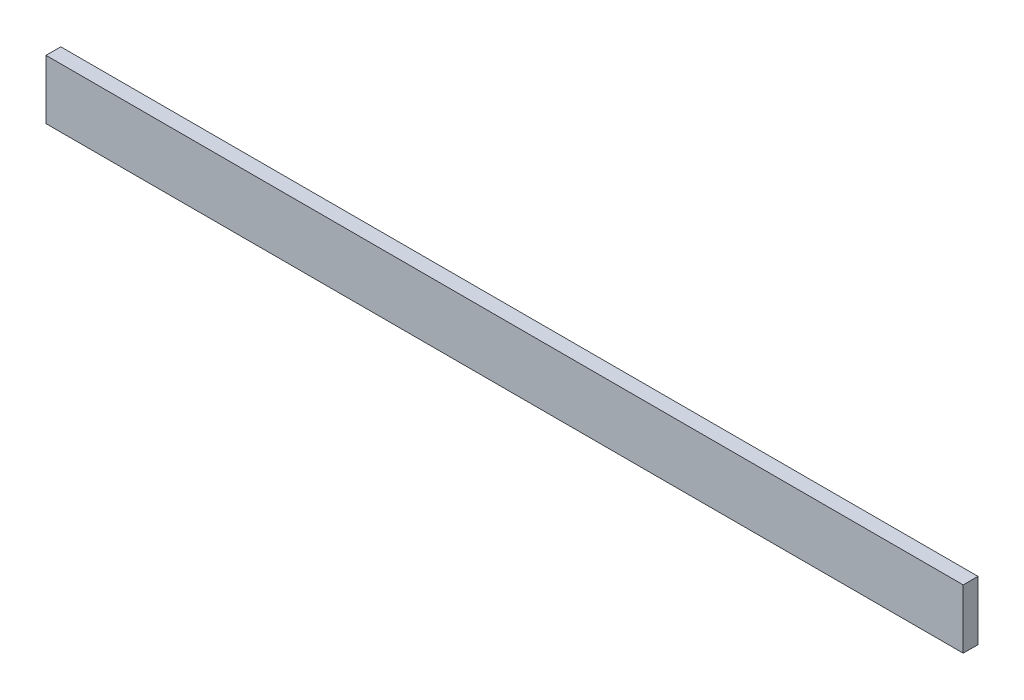
from build123d import *

# Parameters (mm, degrees)
ESQUISSE1_W        = 310
ESQUISSE1_H        = 20
BOSS_EXTRU_1_DEPTH = 5


with BuildPart() as part:
    # Esquisse1 → Boss.-Extru.1 (new body)
    with BuildSketch(Plane.XY):
        with Locations((155, 10)):
            Rectangle(ESQUISSE1_W, ESQUISSE1_H)
    extrude(amount=BOSS_EXTRU_1_DEPTH)


solid = part.part
